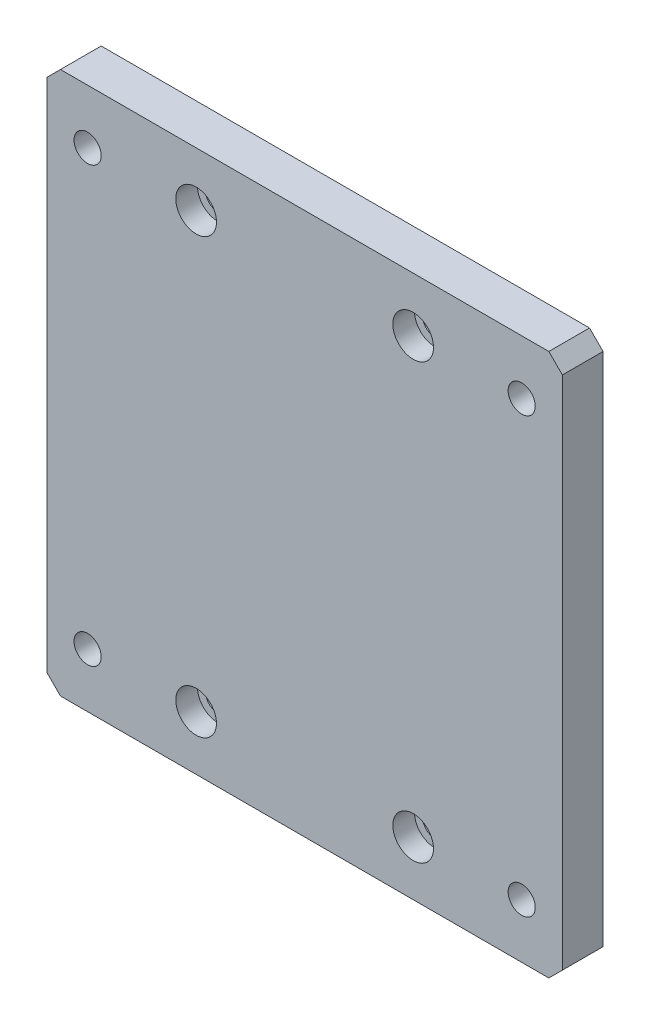
from build123d import *

# Parameters (mm, degrees)
CROQUIS1_W                                           = 190
CROQUIS1_H                                           = 200
SALIENTE_EXTRUIR1_DEPTH                              = 15
CROQUIS2_R                                           = 4
CORTAR_EXTRUIR1_DEPTH                                = 139.744369255
CROQUIS3_R                                           = 5
CORTAR_EXTRUIR2_DEPTH                                = 139.744369255
CHAFL_N1_SIZE                                        = 5
REFRENTADO_PARA_TORNILLO_TAP_N_CON_CABEZ_D           = 9
REFRENTADO_PARA_TORNILLO_TAP_N_CON_CABEZ_CBORE_D     = 15
REFRENTADO_PARA_TORNILLO_TAP_N_CON_CABEZ_CBORE_DEPTH = 8


with BuildPart() as part:
    # Croquis1 → Saliente-Extruir1 (new body)
    with BuildSketch(Plane.XY):
        Rectangle(CROQUIS1_W, CROQUIS1_H)
    extrude(amount=SALIENTE_EXTRUIR1_DEPTH)

    # Croquis2 → Cortar-Extruir1 (cut, through all)
    with BuildSketch(Plane.XY.offset(15)):
        with Locations((-40, 80)):
            Circle(CROQUIS2_R)
        with Locations((40, 80)):
            Circle(CROQUIS2_R)
        with Locations((40, -80)):
            Circle(CROQUIS2_R)
        with Locations((-40, -80)):
            Circle(CROQUIS2_R)
    extrude(amount=-CORTAR_EXTRUIR1_DEPTH, mode=Mode.SUBTRACT)

    # Croquis3 → Cortar-Extruir2 (cut, through all)
    with BuildSketch(Plane.XY.offset(15)):
        with Locations((-80, 80)):
            Circle(CROQUIS3_R)
        with Locations((80, 80)):
            Circle(CROQUIS3_R)
        with Locations((80, -80)):
            Circle(CROQUIS3_R)
        with Locations((-80, -80)):
            Circle(CROQUIS3_R)
    extrude(amount=-CORTAR_EXTRUIR2_DEPTH, mode=Mode.SUBTRACT)

    # Chaflán1
    chafl_n1_edges = [part.edges().sort_by_distance(p)[0] for p in [
        (95, -100, 7.5),
        (-95, -100, 7.5),
        (-95, 100, 7.5),
        (95, 100, 7.5),
    ]]
    chamfer(chafl_n1_edges, length=CHAFL_N1_SIZE)

    # Refrentado para tornillo tapón con cabeza de clavija de M81 (through all)
    with Locations(Plane.XY.offset(15)):
        with Locations((40, 80), (-40, 80), (-40, -80), (40, -80)):
            CounterBoreHole(REFRENTADO_PARA_TORNILLO_TAP_N_CON_CABEZ_D / 2, REFRENTADO_PARA_TORNILLO_TAP_N_CON_CABEZ_CBORE_D / 2, REFRENTADO_PARA_TORNILLO_TAP_N_CON_CABEZ_CBORE_DEPTH)


solid = part.part
